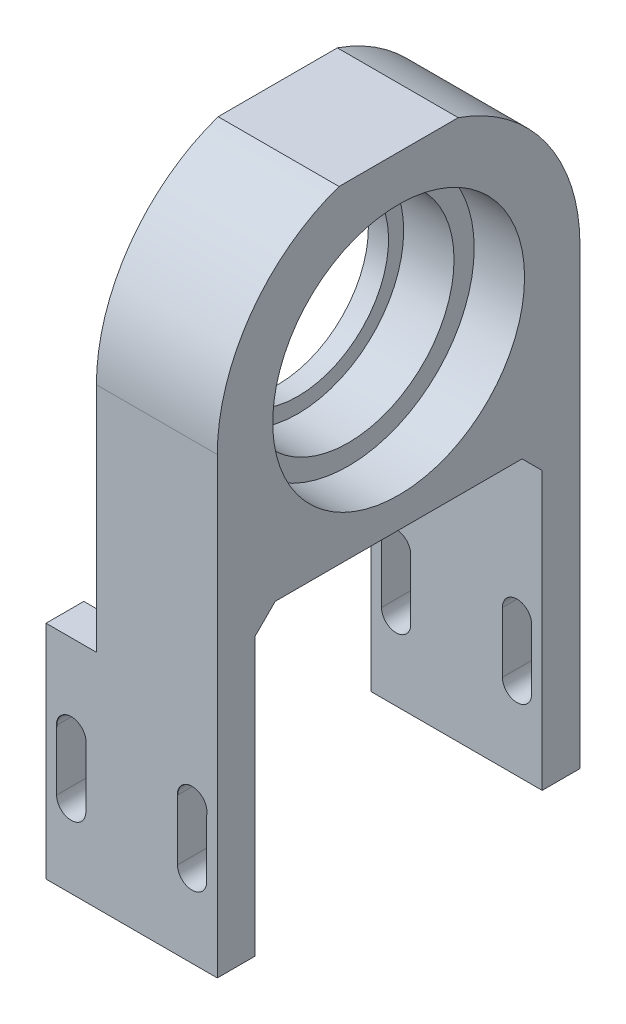
from build123d import *

# Parameters (mm, degrees)
BOSS_EXTRUDE1_DEPTH              = 36
SKETCH2_R                        = 10.5
CUT_EXTRUDE1_DEPTH               = 74.681748079
SKETCH3_W                        = 28.5
SKETCH3_H                        = 29.5
CUT_EXTRUDE2_DEPTH               = 74.681748079
CHAMFER1_SIZE                    = 2
BOSS_EXTRUDE2_START              = -2
SKETCH6_R                        = 10.5
SKETCH6_R_2                      = 9
BOSS_EXTRUDE2_DEPTH              = 2
SKETCH10_R                       = 15
SKETCH10_R_2                     = 11
CUT_EXTRUDE4_DEPTH               = 0.6
SKETCH11_R                       = 12.5
CUT_EXTRUDE5_DEPTH               = 5
M2_5_CLEARANCE_HOLE1_D           = 2.9
M2_5_CLEARANCE_HOLE1_CSINK_D     = 2.95
M2_5_CLEARANCE_HOLE1_CSINK_ANGLE = 90
CUT_EXTRUDE6_DEPTH               = 74.681748079
CUT_EXTRUDE7_DEPTH               = 74.681748079


with BuildPart() as part:
    # Sketch1 → Boss-Extrude1 (new body)
    with BuildSketch(Plane.XY):
        Polygon((0, 0), (17, 0), (17, 29), (17, 62), (5, 62), (5, 22), (0, 22), align=None)
    extrude(amount=BOSS_EXTRUDE1_DEPTH)

    # Sketch2 → Cut-Extrude1 (cut, through all)
    with BuildSketch(Plane(origin=(17, 0, 0), x_dir=(0, 0, -1), z_dir=(1, 0, 0))):
        with Locations(Location((-18, 45, 0), (0, 0, 90))):
            Circle(SKETCH2_R)
    extrude(amount=-CUT_EXTRUDE1_DEPTH, mode=Mode.SUBTRACT)

    # Sketch3 → Cut-Extrude2 (cut, through all)
    with BuildSketch(Plane(origin=(17, 0, 0), x_dir=(0, 0, -1), z_dir=(1, 0, 0))):
        with Locations((-18, 14.75)):
            Rectangle(SKETCH3_W, SKETCH3_H)
    extrude(amount=-CUT_EXTRUDE2_DEPTH, mode=Mode.SUBTRACT)

    # Chamfer1
    chamfer1_edges = [part.edges().sort_by_distance(p)[0] for p in [
        (11, 29.5, 32.25),
        (11, 29.5, 3.75),
    ]]
    chamfer(chamfer1_edges, length=CHAMFER1_SIZE)

    # Sketch6 → Boss-Extrude2 (add)
    with BuildSketch(Plane.ZY.offset(-5).offset(BOSS_EXTRUDE2_START)):
        with Locations(Location((18, 45, 0), (0, 0, 90))):
            Circle(SKETCH6_R)
        with Locations(Location((18, 45, 0), (0, 0, 270))):
            Circle(SKETCH6_R_2, mode=Mode.SUBTRACT)
    extrude(amount=BOSS_EXTRUDE2_DEPTH)

    # Sketch10 → Cut-Extrude4 (cut)
    with BuildSketch(Plane.ZY.offset(-5)):
        with Locations(Location((18, 45, 0), (0, 0, 270))):
            Circle(SKETCH10_R)
        with Locations(Location((18, 45, 0), (0, 0, 270))):
            Circle(SKETCH10_R_2, mode=Mode.SUBTRACT)
    extrude(amount=-CUT_EXTRUDE4_DEPTH, mode=Mode.SUBTRACT)

    # Sketch11 → Cut-Extrude5 (cut)
    with BuildSketch(Plane(origin=(17, 0, 0), x_dir=(0, 0, -1), z_dir=(1, 0, 0))):
        with Locations((-18, 45)):
            Circle(SKETCH11_R)
    extrude(amount=-CUT_EXTRUDE5_DEPTH, mode=Mode.SUBTRACT)

    # M2.5 Clearance Hole1 (through all)
    with Locations(Plane.XY.offset(36)):
        with Locations((14.5, 13.75), (2.5, 13.75)):
            CounterSinkHole(M2_5_CLEARANCE_HOLE1_D / 2, M2_5_CLEARANCE_HOLE1_CSINK_D / 2, counter_sink_angle=M2_5_CLEARANCE_HOLE1_CSINK_ANGLE)

    # Sketch15 → Cut-Extrude6 (cut, through all)
    with BuildSketch(Plane(origin=(0, 0, 0), x_dir=(-1, 0, 0), z_dir=(0, 0, -1))):
        with BuildLine():
            Line((-13.05, 13.75), (-13.05, 7.75))
            ThreePointArc((-13.05, 7.75), (-14.5, 6.3), (-15.95, 7.75))
            Line((-15.95, 7.75), (-15.95, 13.75))
            ThreePointArc((-15.95, 13.75), (-14.5, 15.2), (-13.05, 13.75))
        make_face()
        with BuildLine():
            Line((-1.05, 13.75), (-1.05, 7.75))
            ThreePointArc((-1.05, 7.75), (-2.5, 6.3), (-3.95, 7.75))
            Line((-3.95, 7.75), (-3.95, 13.75))
            ThreePointArc((-3.95, 13.75), (-2.5, 15.2), (-1.05, 13.75))
        make_face()
    extrude(amount=-CUT_EXTRUDE6_DEPTH, mode=Mode.SUBTRACT)

    # Sketch17 → Cut-Extrude7 (cut, through all)
    with BuildSketch(Plane(origin=(17, 0, 0), x_dir=(0, 0, -1), z_dir=(1, 0, 0))):
        with BuildLine():
            Line((-23.916079783, 62), (-36, 62))
            Line((-36, 62), (-36, 45))
            ThreePointArc((-36, 45), (-32.671220742, 55.428580054), (-23.916079783, 62))
        make_face()
        with BuildLine():
            Line((0, 62), (-12.083920217, 62))
            ThreePointArc((-12.083920217, 62), (-3.328779258, 55.428580054), (0, 45))
            Line((0, 45), (0, 62))
        make_face()
    extrude(amount=-CUT_EXTRUDE7_DEPTH, mode=Mode.SUBTRACT)


solid = part.part
